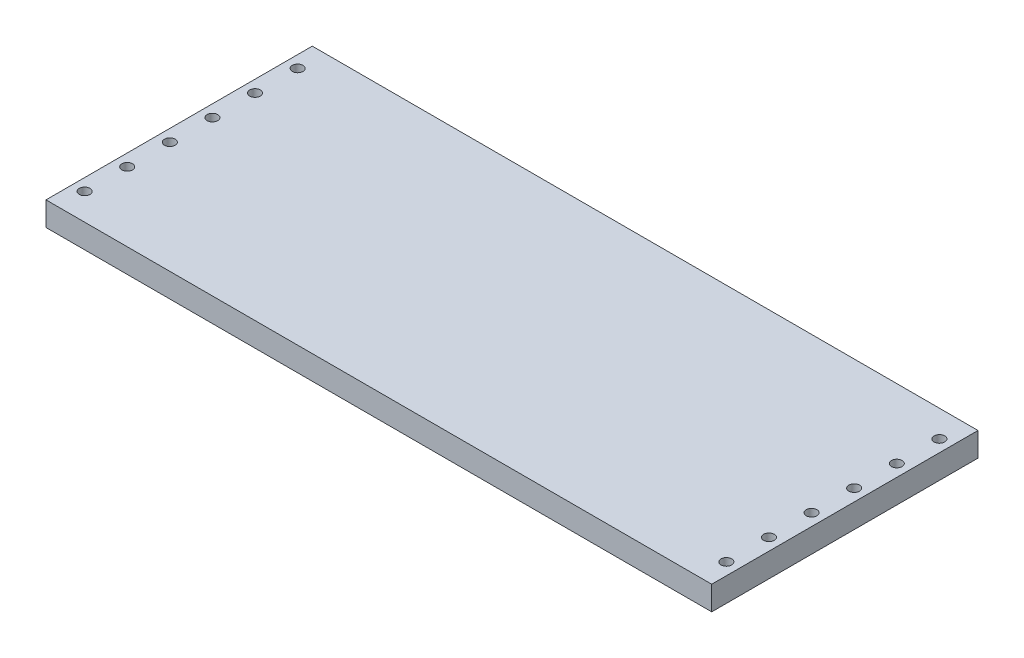
from build123d import *

# Parameters (mm, degrees)
SKETCH1_W           = 500
SKETCH1_H           = 200
BOSS_EXTRUDE1_DEPTH = 18
SKETCH2_R           = 4
CUT_EXTRUDE1_DEPTH  = 10


with BuildPart() as part:
    # Sketch1 → Boss-Extrude1 (new body)
    with BuildSketch(Plane(origin=(0, 0, 0), x_dir=(1, 0, 0), z_dir=(0, 1, 0))):
        with Locations((250, 100)):
            Rectangle(SKETCH1_W, SKETCH1_H)
    extrude(amount=BOSS_EXTRUDE1_DEPTH)

    # Sketch2 → Cut-Extrude1 (cut)
    with BuildSketch(Plane(origin=(0, 18, 0), x_dir=(1, 0, 0), z_dir=(0, 1, 0))):
        with Locations(Location((9, 180, 0), (0, 0, 270))):
            Circle(SKETCH2_R)
        with Locations(Location((9, 148, 0), (0, 0, 270))):
            Circle(SKETCH2_R)
        with Locations(Location((9, 116, 0), (0, 0, 270))):
            Circle(SKETCH2_R)
        with Locations(Location((9, 84, 0), (0, 0, 270))):
            Circle(SKETCH2_R)
        with Locations(Location((9, 52, 0), (0, 0, 270))):
            Circle(SKETCH2_R)
        with Locations(Location((9, 20, 0), (0, 0, 270))):
            Circle(SKETCH2_R)
        with Locations(Location((491, 20, 0), (0, 0, 90))):
            Circle(SKETCH2_R)
        with Locations(Location((491, 52, 0), (0, 0, 90))):
            Circle(SKETCH2_R)
        with Locations(Location((491, 84, 0), (0, 0, 90))):
            Circle(SKETCH2_R)
        with Locations(Location((491, 116, 0), (0, 0, 90))):
            Circle(SKETCH2_R)
        with Locations(Location((491, 148, 0), (0, 0, 90))):
            Circle(SKETCH2_R)
        with Locations(Location((491, 180, 0), (0, 0, 90))):
            Circle(SKETCH2_R)
    extrude(amount=-CUT_EXTRUDE1_DEPTH, mode=Mode.SUBTRACT)


solid = part.part
